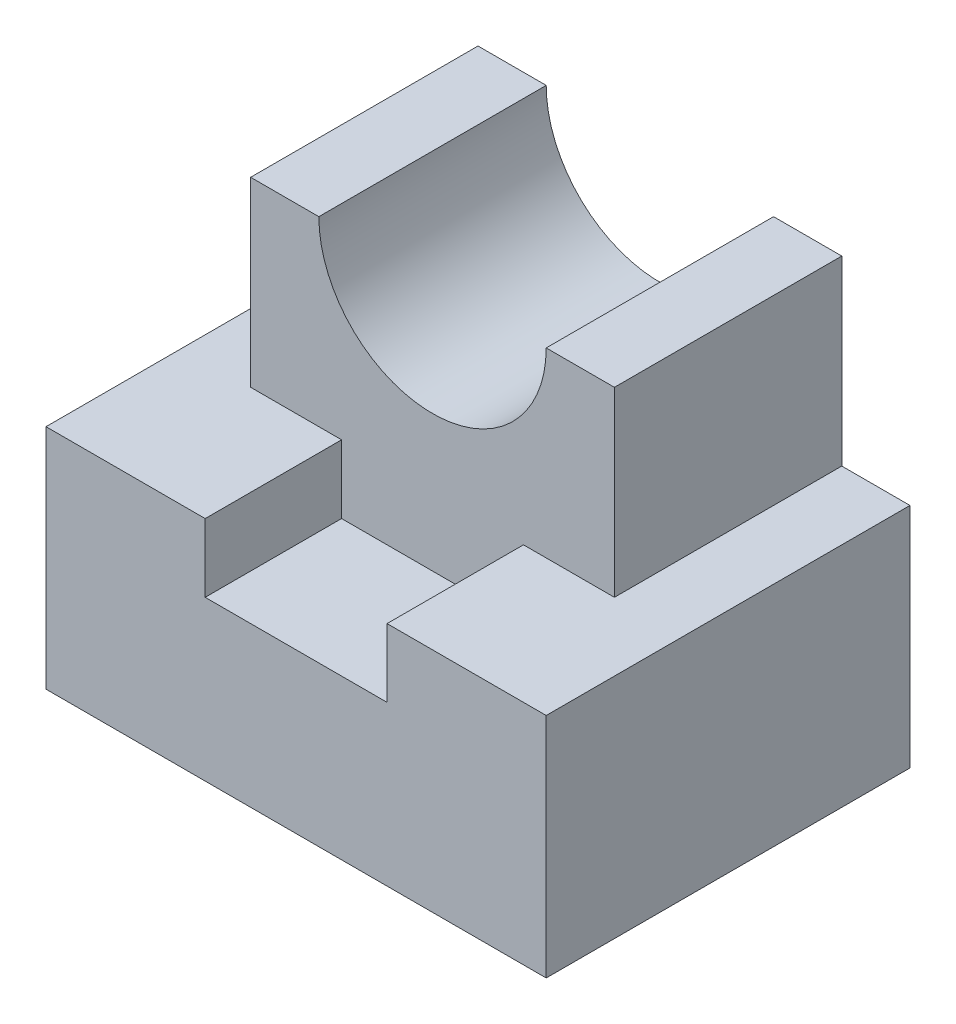
from build123d import *

# Parameters (mm, degrees)
SKETCH3_W               = 110
SKETCH3_H               = 80
BOSS_EXTRUDE2_DEPTH     = 50
SKETCH6_W               = 80
SKETCH6_H               = 50
BOSS_EXTRUDE3_DEPTH     = 90
SKETCH7_R               = 25
CUT_EXTRUDE1_DEPTH      = 133.382022949
CUT_EXTRUDE2_DEPTH      = 133.382022949
CUT_EXTRUDE2_DEPTH_BACK = 30
SKETCH8_W               = 40
SKETCH8_H               = 15


with BuildPart() as part:
    # Sketch3 → Boss-Extrude2 (new body)
    with BuildSketch(Plane(origin=(0, 0, 0), x_dir=(1, 0, 0), z_dir=(0, 1, 0))):
        Rectangle(SKETCH3_W, SKETCH3_H)
    extrude(amount=BOSS_EXTRUDE2_DEPTH)

    # Sketch6 → Boss-Extrude3 (add)
    with BuildSketch(Plane.XZ):
        with Locations((0, -15)):
            Rectangle(SKETCH6_W, SKETCH6_H)
    extrude(amount=-BOSS_EXTRUDE3_DEPTH)

    # Sketch7 → Cut-Extrude1 (cut, through all)
    with BuildSketch(Plane(origin=(0, 0, -40), x_dir=(-1, 0, 0), z_dir=(0, 0, -1))):
        with Locations((0, 90)):
            Circle(SKETCH7_R)
    extrude(amount=-CUT_EXTRUDE1_DEPTH, mode=Mode.SUBTRACT)

    # Sketch8 → Cut-Extrude2 (cut, two sides: drawn at the far end of the back side and taken through both)
    with BuildSketch(Plane.XY.offset(40).offset(-CUT_EXTRUDE2_DEPTH_BACK)):
        with Locations((0, 42.5)):
            Rectangle(SKETCH8_W, SKETCH8_H)
    extrude(amount=CUT_EXTRUDE2_DEPTH + CUT_EXTRUDE2_DEPTH_BACK, mode=Mode.SUBTRACT)


solid = part.part
